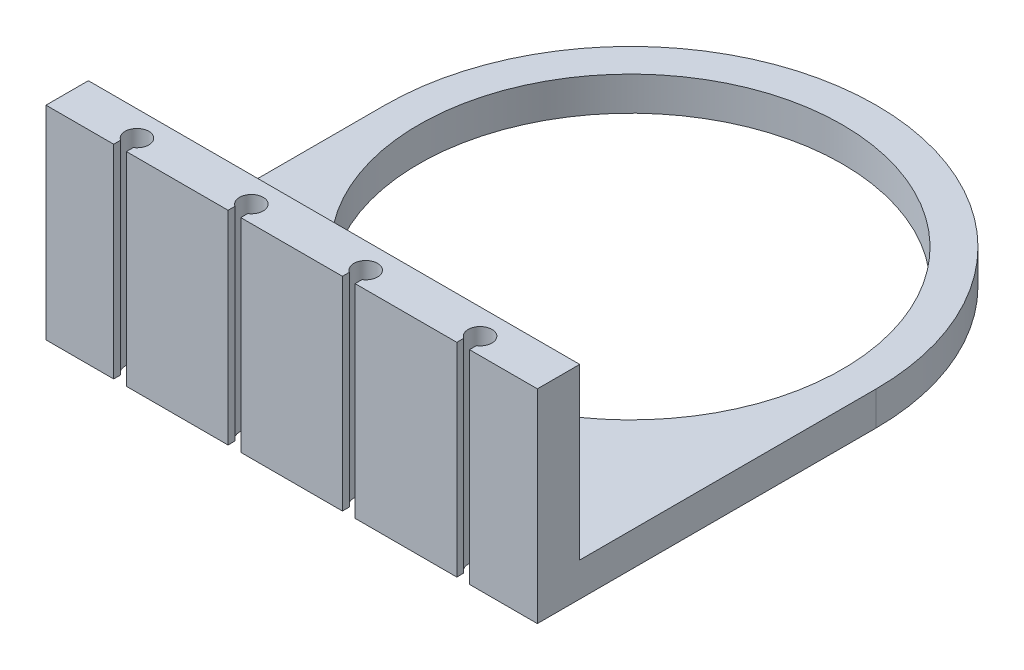
from build123d import *

# Parameters (mm, degrees)
SKETCH1_R               = 72.5
SKETCH1_R_2             = 62.5
BOSS_EXTRUDE1_DEPTH     = 10
SKETCH2_W               = 25
SKETCH2_H               = 10
BOSS_EXTRUDE2_DEPTH     = 100
SKETCH3_W               = 145
SKETCH3_H               = 50
BOSS_EXTRUDE3_DEPTH     = 10
CUT_EXTRUDE1_START      = -10
SKETCH4_R               = 62.5
CUT_EXTRUDE1_DEPTH      = 10
SKETCH5_W               = 145
SKETCH5_H               = 12.5
BOSS_EXTRUDE4_DEPTH     = 50
CUT_EXTRUDE2_DEPTH      = 138.318061449
CUT_EXTRUDE2_DEPTH_BACK = 138.318061449
SKETCH6_R               = 3.5
CUT_EXTRUDE3_DEPTH      = 138.318061449
CUT_EXTRUDE3_DEPTH_BACK = 138.318061449
SKETCH7_W               = 3.75
SKETCH7_H               = 5


with BuildPart() as part:
    # Sketch1 → Boss-Extrude1 (new body)
    with BuildSketch(Plane(origin=(0, 0, 0), x_dir=(1, 0, 0), z_dir=(0, 1, 0))):
        with Locations(Location((0, 0, 0), (0, 0, 270))):
            Circle(SKETCH1_R)
        with Locations(Location((0, 0, 0), (0, 0, 270))):
            Circle(SKETCH1_R_2, mode=Mode.SUBTRACT)
    extrude(amount=BOSS_EXTRUDE1_DEPTH)

    # Sketch2 → Boss-Extrude2 (add)
    with BuildSketch(Plane.XY):
        with Locations((-60, 5)):
            Rectangle(SKETCH2_W, SKETCH2_H)
        with Locations((60, 5)):
            Rectangle(SKETCH2_W, SKETCH2_H)
    extrude(amount=BOSS_EXTRUDE2_DEPTH)

    # Sketch3 → Boss-Extrude3 (add)
    with BuildSketch(Plane(origin=(0, 10, 0), x_dir=(1, 0, 0), z_dir=(0, 1, 0))):
        with Locations((0, -75)):
            Rectangle(SKETCH3_W, SKETCH3_H)
    extrude(amount=-BOSS_EXTRUDE3_DEPTH)

    # Sketch4 → Cut-Extrude1 (cut)
    with BuildSketch(Plane(origin=(0, 10, 0), x_dir=(1, 0, 0), z_dir=(0, 1, 0)).offset(CUT_EXTRUDE1_START)):
        with Locations(Location((0, 0, 0), (0, 0, 270))):
            Circle(SKETCH4_R)
    extrude(amount=CUT_EXTRUDE1_DEPTH, mode=Mode.SUBTRACT)

    # Sketch5 → Boss-Extrude4 (add)
    with BuildSketch(Plane(origin=(0, 10, 0), x_dir=(1, 0, 0), z_dir=(0, 1, 0))):
        with Locations((0, -93.75)):
            Rectangle(SKETCH5_W, SKETCH5_H)
    extrude(amount=BOSS_EXTRUDE4_DEPTH)

    # Sketch6 → Cut-Extrude2 (cut, two sides: drawn at the far end of the back side and taken through both)
    with BuildSketch(Plane.XZ.offset(-CUT_EXTRUDE2_DEPTH_BACK)):
        with Locations(Location((-50.65, 95, 0), (0, 0, 270))):
            Circle(SKETCH6_R)
        with Locations(Location((-16.9, 95, 0), (0, 0, 270))):
            Circle(SKETCH6_R)
        with Locations(Location((16.85, 95, 0), (0, 0, 270))):
            Circle(SKETCH6_R)
        with Locations(Location((50.6, 95, 0), (0, 0, 270))):
            Circle(SKETCH6_R)
    extrude(amount=CUT_EXTRUDE2_DEPTH + CUT_EXTRUDE2_DEPTH_BACK, mode=Mode.SUBTRACT)

    # Sketch7 → Cut-Extrude3 (cut, two sides: drawn at the far end of the back side and taken through both)
    with BuildSketch(Plane.XZ.offset(-CUT_EXTRUDE3_DEPTH_BACK)):
        with Locations((-16.9, 100)):
            Rectangle(SKETCH7_W, SKETCH7_H)
        with Locations((-50.65, 100)):
            Rectangle(SKETCH7_W, SKETCH7_H)
        with Locations((16.85, 100)):
            Rectangle(SKETCH7_W, SKETCH7_H)
        with Locations((50.6, 100)):
            Rectangle(SKETCH7_W, SKETCH7_H)
    extrude(amount=CUT_EXTRUDE3_DEPTH + CUT_EXTRUDE3_DEPTH_BACK, mode=Mode.SUBTRACT)


solid = part.part
